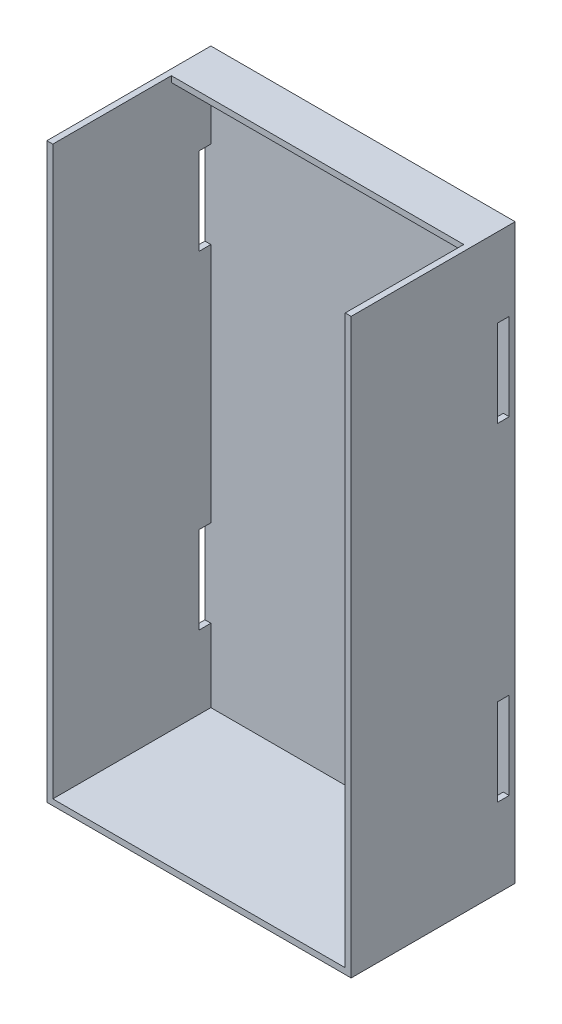
from build123d import *

# Parameters (mm, degrees)
SKETCH_1_W          = 77
SKETCH_1_H          = 145
EXTRUDE_1_DEPTH     = 1.5
EXTRUDE_2_DEPTH     = 40
SKETCH_3_W          = 74
SKETCH_3_H          = 1.5
EXTRUDE_3_DEPTH     = 10
SKETCH_4_W          = 3
SKETCH_4_H          = 22
CUT_EXTRUDE_1_DEPTH = 100


with BuildPart() as part:
    # Эскиз1 → Бобышка-Вытянуть1 (new body)
    with BuildSketch(Plane.XY):
        with Locations((38.5, 72.5)):
            Rectangle(SKETCH_1_W, SKETCH_1_H)
    extrude(amount=EXTRUDE_1_DEPTH)

    # Эскиз2 → Бобышка-Вытянуть2 (add)
    with BuildSketch(Plane.XY.offset(1.5)):
        Polygon((1.5, 145), (1.5, 1.5), (75.5, 1.5), (75.5, 145), (77, 145), (77, 0), (0, 0), (0, 145), align=None)
    extrude(amount=EXTRUDE_2_DEPTH)

    # Эскиз3 → Бобышка-Вытянуть3 (add)
    with BuildSketch(Plane.XY.offset(1.5)):
        with Locations((38.5, 144.25)):
            Rectangle(SKETCH_3_W, SKETCH_3_H)
    extrude(amount=EXTRUDE_3_DEPTH)

    # Эскиз4 → Вырез-Вытянуть1 (cut)
    with BuildSketch(Plane(origin=(77, 0, 0), x_dir=(0, 0, -1), z_dir=(1, 0, 0))):
        with Locations((-3, 114)):
            Rectangle(SKETCH_4_W, SKETCH_4_H)
        with Locations((-3, 31)):
            Rectangle(SKETCH_4_W, SKETCH_4_H)
    extrude(amount=-CUT_EXTRUDE_1_DEPTH, mode=Mode.SUBTRACT)


solid = part.part
